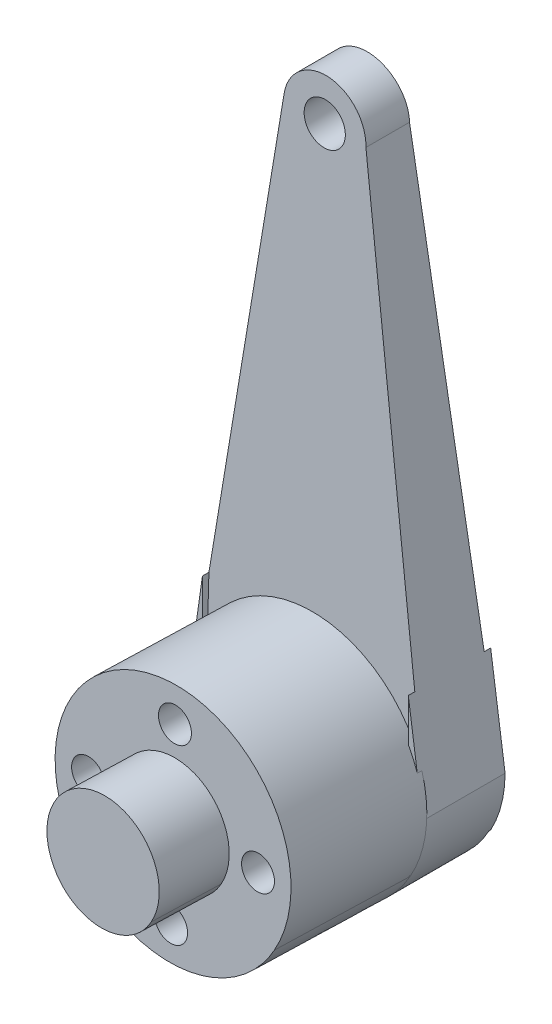
from build123d import *

# Parameters (mm, degrees)
SKETCH1_R           = 8.5
SKETCH1_R_2         = 5
BOSS_EXTRUDE1_DEPTH = 10
CUT_EXTRUDE1_DEPTH  = 25
BOSS_EXTRUDE2_DEPTH = 50
CUT_EXTRUDE2_REACH  = 159.194
SKETCH4_R           = 5
CUT_EXTRUDE3_REACH  = 156.975
SKETCH5_W           = 19
SKETCH5_H           = 15
CUT_EXTRUDE4_START  = -17
CUT_EXTRUDE4_DEPTH  = 17
SKETCH7_R           = 4
CUT_EXTRUDE5_DEPTH  = 17
BOSS_EXTRUDE3_REACH = 159.194
SKETCH8_R           = 5


with BuildPart() as part:
    # Sketch1 → Boss-Extrude1 (new, symmetric)
    with BuildSketch(Plane.XY):
        with BuildLine():
            ThreePointArc((10, 130), (0.702455902, 139.975297274), (-9.901311141, 131.401441289))
            Line((-9.901311141, 131.401441289), (-27.380498519, 7.90938056))
            Line((-27.380498519, 7.90938056), (-28.5, 0))
            ThreePointArc((-28.5, 0), (0, -28.5), (28.5, 0))
            Line((28.5, 0), (27.368578637, 7.950528498))
            Line((27.368578637, 7.950528498), (10, 130))
        make_face()
        Circle(SKETCH1_R, mode=Mode.SUBTRACT)
        with Locations((0, 130)):
            Circle(SKETCH1_R_2, mode=Mode.SUBTRACT)
    extrude(amount=BOSS_EXTRUDE1_DEPTH, both=True)

    # Sketch2 → Cut-Extrude1 (cut, symmetric)
    with BuildSketch(Plane(origin=(0, 0, 0), x_dir=(0, 0, -1), z_dir=(1, 0, 0))):
        Polygon((-5, 140), (-10, -28.5), (-10, 140), align=None)
    cut_extrude1 = extrude(amount=CUT_EXTRUDE1_DEPTH, both=True, mode=Mode.SUBTRACT)

    # Mirror1: Cut-Extrude1 across plane
    add(cut_extrude1.mirror(Plane.XY), mode=Mode.SUBTRACT)

    # Sketch3 → Boss-Extrude2 (add)
    with BuildSketch(Plane(origin=(0, 0.271402053, 9.146249197), x_dir=(1, 0, 0), z_dir=(0, 0.02966053500132691, 0.9995600295447169))):
        with BuildLine():
            ThreePointArc((-25, -13.961476874), (0, 28.634294762), (25, -13.961476874))
            add(Edge.make_bspline(
                [(-25, -13.961476874), (0, -59.655586885), (25, -13.961476874)],
                knots=[2.07160832, 2.07160832, 2.07160832, 4.211576987, 4.211576987, 4.211576987], degree=2, weights=[1, 0.480137971, 1]))
        make_face()
    extrude(amount=BOSS_EXTRUDE2_DEPTH)

    # Sketch4 → Cut-Extrude2 (cut, up to next)
    with BuildSketch(Plane(origin=(0, 1.754428803, 59.124250674), x_dir=(1, 0, 0), z_dir=(0, 0.029660535001326913, 0.9995600295447169)), mode=Mode.PRIVATE) as cut_extrude2_sk1:
        with Locations(Location((0, 0, 0), (0, 0, 270))):
            Circle(SKETCH4_R)
    cut_extrude2_tool1 = extrude(cut_extrude2_sk1.sketch, amount=-CUT_EXTRUDE2_REACH, mode=Mode.PRIVATE) & part.part
    add(cut_extrude2_tool1.solids().sort_by_distance((0, 1.754429, 59.124251))[0], mode=Mode.SUBTRACT)

    # Sketch5 → Cut-Extrude3 (cut, up to next)
    with BuildSketch(Plane(origin=(0, 0, 0), x_dir=(1, 0, 0), z_dir=(0, 1, 0)), mode=Mode.PRIVATE) as cut_extrude3_sk1:
        with Locations((0, -17.5)):
            Rectangle(SKETCH5_W, SKETCH5_H)
    cut_extrude3_tool1 = extrude(cut_extrude3_sk1.sketch, amount=-CUT_EXTRUDE3_REACH, mode=Mode.PRIVATE) & part.part
    add(cut_extrude3_tool1.solids().sort_by_distance((0, 0, 17.5))[0], mode=Mode.SUBTRACT)

    # Sketch6 → Cut-Extrude4 (cut)
    with BuildSketch(Plane(origin=(0, 1.754428803, 59.124250674), x_dir=(1, 0, 0), z_dir=(0, 0.029660535001326913, 0.9995600295447168)).offset(CUT_EXTRUDE4_START)):
        with BuildLine():
            ThreePointArc((25, -13.961476874), (0, 28.634294762), (-25, -13.961476874))
            add(Edge.make_bspline(
                [(-25, -13.961476874), (0, -59.655586885), (25, -13.961476874)],
                knots=[2.07160832, 2.07160832, 2.07160832, 4.211576987, 4.211576987, 4.211576987], degree=2, weights=[1, 0.480137971, 1]))
        make_face()
        with BuildLine():
            add(Edge.make_bspline(
                [(-11.871872779, -6.70467228), (-11.297921787, -7.765822714), (-9.855955264, -9.743319402), (-6.038165372, -12.782735574), (0, -14.451619937), (6.038165372, -12.782735574), (9.855955264, -9.743319402), (11.297921787, -7.765822714), (11.871872779, -6.70467228)],
                knots=[2.06679188, 2.06679188, 2.06679188, 2.06679188, 2.335492074, 2.604192267, 3.141592654, 3.67899304, 3.947693234, 4.216393427, 4.216393427, 4.216393427, 4.216393427], degree=3))
            ThreePointArc((11.871872779, -6.70467228), (0, 13.634294762), (-11.871872779, -6.70467228))
        make_face(mode=Mode.SUBTRACT)
    extrude(amount=CUT_EXTRUDE4_DEPTH, mode=Mode.SUBTRACT)

    # Sketch7 → Cut-Extrude5 (cut)
    with BuildSketch(Plane(origin=(0, 1.250199708, 42.131730172), x_dir=(1, 0, 0), z_dir=(0, 0.029660535001326933, 0.9995600295447168))):
        with Locations(Location((20.634294762, 0, 0), (0, 0, 270))):
            Circle(SKETCH7_R)
        with Locations(Location((0.15140188, -20.783506756, 0), (0, 0, 270))):
            Circle(SKETCH7_R)
        with Locations(Location((-20.632104876, -0.300613874, 0), (0, 0, 270))):
            Circle(SKETCH7_R)
        with Locations(Location((-0.149211994, 20.482892882, 0), (0, 0, 270))):
            Circle(SKETCH7_R)
    extrude(amount=-CUT_EXTRUDE5_DEPTH, mode=Mode.SUBTRACT)

    # Boss-Extrude3: up to this face of the body (flat: up to its plane)
    boss_extrude3_end = Plane(part.part.faces().sort_by_distance((-1e-09, -14.541060852, 25))[0])
    # Sketch8 → Boss-Extrude3 (add, up to the picked face)
    with BuildSketch(Plane(origin=(0, 1.754428803, 59.124250674), x_dir=(1, 0, 0), z_dir=(0, 0.029660535001326913, 0.9995600295447168)), mode=Mode.PRIVATE) as boss_extrude3_sk1:
        with Locations(Location((0, 0, 0), (0, 0, 270))):
            Circle(SKETCH8_R)
    boss_extrude3_tool1 = split(extrude(boss_extrude3_sk1.sketch, amount=-BOSS_EXTRUDE3_REACH, mode=Mode.PRIVATE), bisect_by=boss_extrude3_end, keep=Keep.BOTH, mode=Mode.PRIVATE)
    add(boss_extrude3_tool1.solids().sort_by(Axis((0, 1.754429, 59.124251), (0, -0.029660535001326913, -0.9995600295447168)))[0])


solid = part.part
